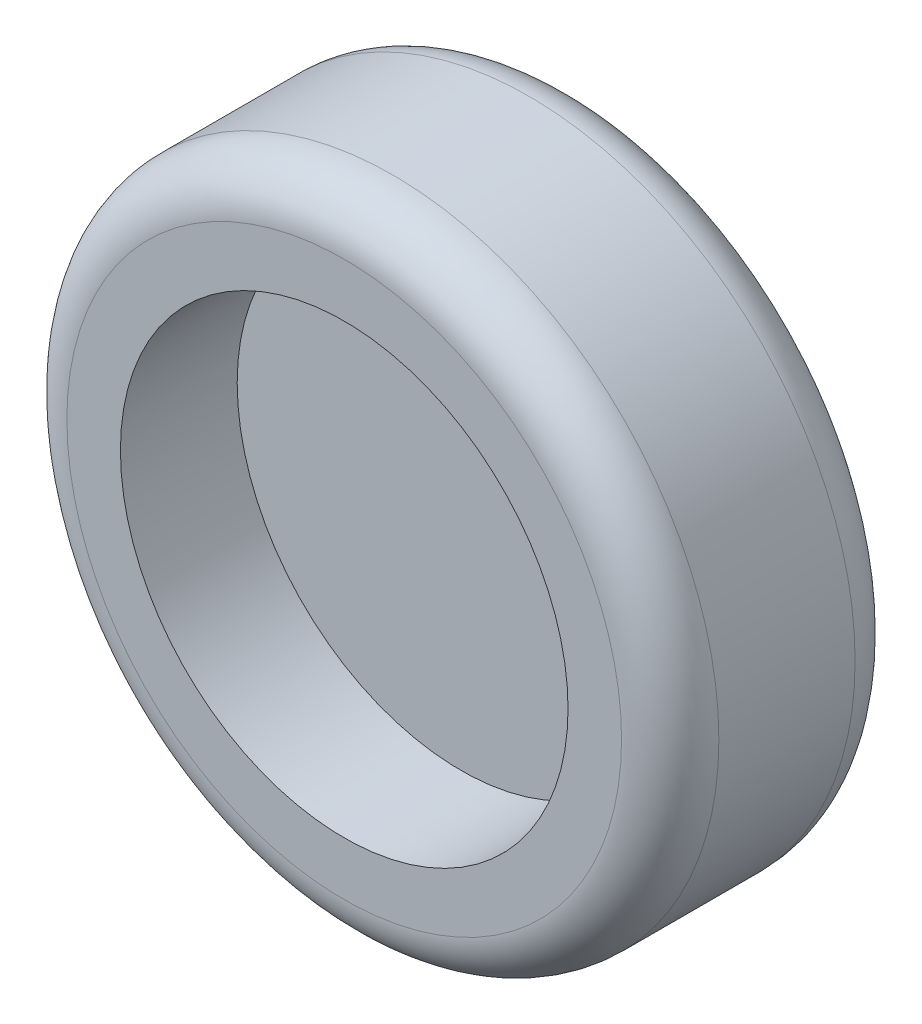
from build123d import *

# Parameters (mm, degrees)
ESQUISSE1_R             = 33.5
BOSS_EXTRU_1_DEPTH      = 24
CONG_1_R                = 5
CONG_2_R                = 5
ESQUISSE2_R             = 23
ENL_V_MAT_EXTRU_1_DEPTH = 12


with BuildPart() as part:
    # Esquisse1 → Boss.-Extru.1 (new body)
    with BuildSketch(Plane.XY):
        Circle(ESQUISSE1_R)
    extrude(amount=BOSS_EXTRU_1_DEPTH)

    # Congé1
    cong_1_edges = [part.edges().sort_by_distance(p)[0] for p in [
        (-33.5, 0, 24),
    ]]
    fillet(cong_1_edges, radius=CONG_1_R)

    # Congé2
    cong_2_edges = [part.edges().sort_by_distance(p)[0] for p in [
        (-33.5, 0, 0),
    ]]
    fillet(cong_2_edges, radius=CONG_2_R)

    # Esquisse2 → Enlèv. mat.-Extru.1 (cut)
    with BuildSketch(Plane.XY.offset(24)):
        Circle(ESQUISSE2_R)
    extrude(amount=-ENL_V_MAT_EXTRU_1_DEPTH, mode=Mode.SUBTRACT)


solid = part.part
